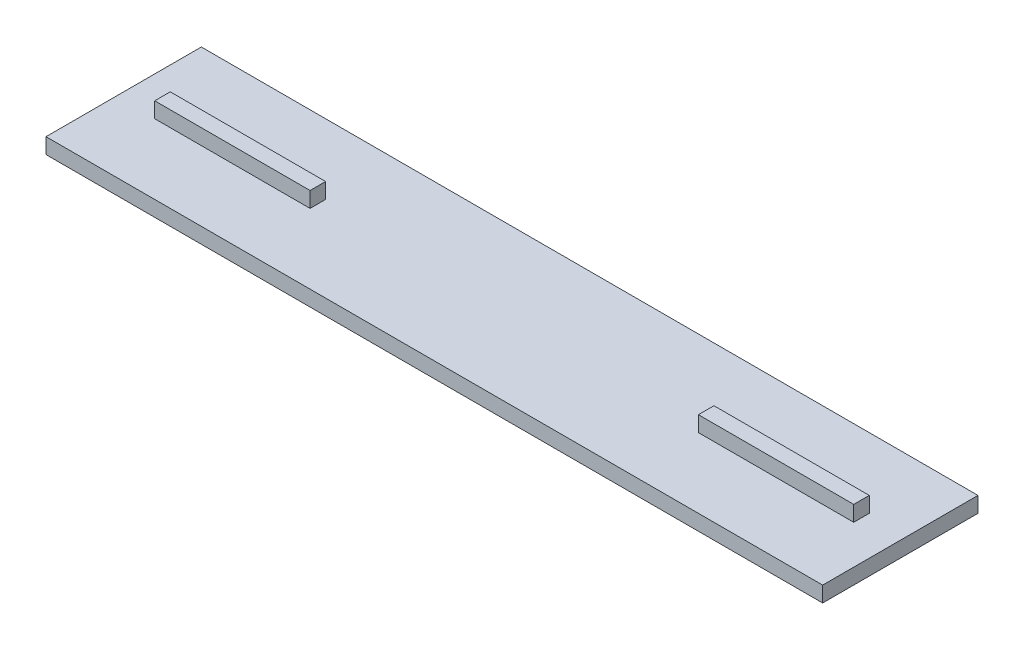
from build123d import *

# Parameters (mm, degrees)
SKETCH1_W           = 100
SKETCH1_H           = 20
BOSS_EXTRUDE1_DEPTH = 2
BOSS_EXTRUDE2_DEPTH = 4


with BuildPart() as part:
    # Sketch1 → Boss-Extrude1 (new body)
    with BuildSketch(Plane(origin=(0, 0, 0), x_dir=(1, 0, 0), z_dir=(0, 1, 0))):
        with Locations((0, -10)):
            Rectangle(SKETCH1_W, SKETCH1_H)
    extrude(amount=BOSS_EXTRUDE1_DEPTH)

    # Sketch2 → Boss-Extrude2 (add)
    with BuildSketch(Plane(origin=(0, 0, 0), x_dir=(1, 0, 0), z_dir=(0, 1, 0))):
        Polygon((-45, -10), (-45, -11), (-25, -11), (-25, -9), (-45, -9), align=None)
        Polygon((45, -10), (45, -9), (25, -9), (25, -11), (45, -11), align=None)
    extrude(amount=BOSS_EXTRUDE2_DEPTH)


solid = part.part
